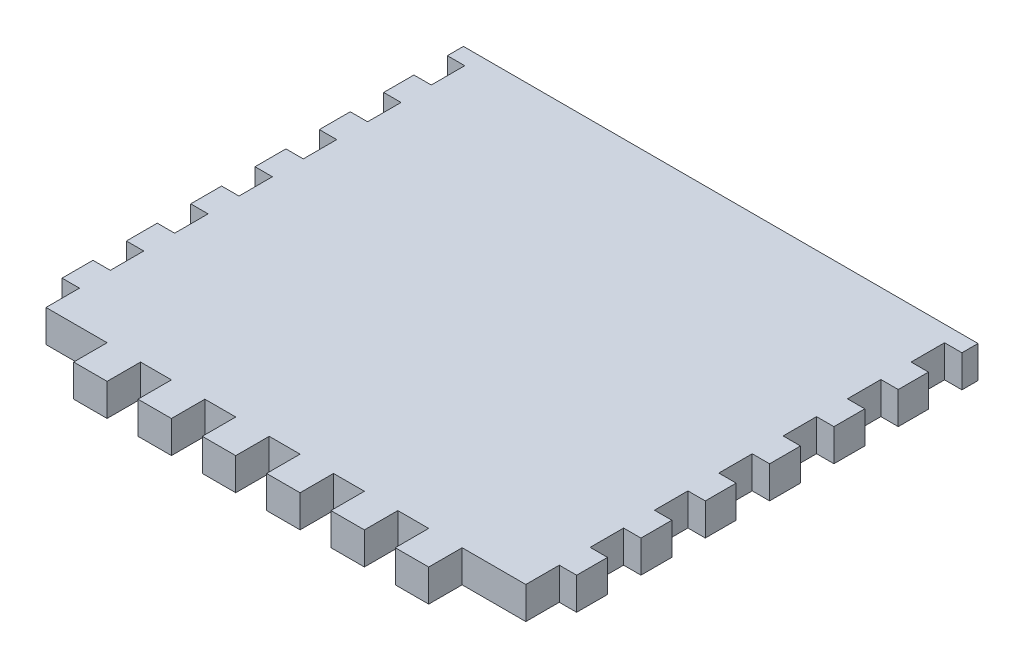
from build123d import *

# Parameters (mm, degrees)
SKETCH1_W               = 101.6
SKETCH1_H               = 107.95
BOSS_EXTRUDE1_DEPTH     = 6.35
CUT_EXTRUDE1_DEPTH      = 75.392628163
CUT_EXTRUDE1_DEPTH_BACK = 75.392628163
SKETCH2_W               = 3.429
SKETCH2_H               = 6.604


with BuildPart() as part:
    # Sketch1 → Boss-Extrude1 (new body)
    with BuildSketch(Plane(origin=(0, 0, 0), x_dir=(1, 0, 0), z_dir=(0, 1, 0))):
        Rectangle(SKETCH1_W, SKETCH1_H)
    extrude(amount=BOSS_EXTRUDE1_DEPTH)

    # Sketch2 → Cut-Extrude1 (cut, two sides: drawn at the far end of the back side and taken through both)
    with BuildSketch(Plane(origin=(0, 6.35, 0), x_dir=(1, 0, 0), z_dir=(0, 1, 0)).offset(-CUT_EXTRUDE1_DEPTH_BACK)):
        Polygon((22.098, -31.877), (28.194, -31.877), (28.194, -38.481), (34.798, -38.481), (34.798, -31.877), (47.371, -31.877), (47.371, -25.273), (50.8, -25.273), (50.8, -31.877), (50.8, -53.975), (-50.8, -53.975), (-50.8, -31.877), (-50.8, -25.273), (-47.371, -25.273), (-47.371, -31.877), (-35.306, -31.877), (-35.306, -38.481), (-28.702, -38.481), (-28.702, -31.877), (-22.606, -31.877), (-22.606, -38.481), (-16.002, -38.481), (-16.002, -31.877), (-9.906, -31.877), (-9.906, -38.481), (-3.302, -38.481), (-3.302, -31.877), (2.794, -31.877), (2.794, -38.481), (9.398, -38.481), (9.398, -31.877), (15.494, -31.877), (15.494, -38.481), (22.098, -38.481), align=None)
        with Locations((-49.0855, 47.498)):
            Rectangle(SKETCH2_W, SKETCH2_H)
        with Locations((-49.0855, 34.925)):
            Rectangle(SKETCH2_W, SKETCH2_H)
        with Locations((-49.0855, 22.225)):
            Rectangle(SKETCH2_W, SKETCH2_H)
        with Locations((-49.0855, 9.525)):
            Rectangle(SKETCH2_W, SKETCH2_H)
        with Locations((-49.0855, -3.175)):
            Rectangle(SKETCH2_W, SKETCH2_H)
        with Locations((-49.0855, -15.875)):
            Rectangle(SKETCH2_W, SKETCH2_H)
        with Locations((49.0855, -15.875)):
            Rectangle(SKETCH2_W, SKETCH2_H)
        with Locations((49.0855, -3.175)):
            Rectangle(SKETCH2_W, SKETCH2_H)
        with Locations((49.0855, 9.525)):
            Rectangle(SKETCH2_W, SKETCH2_H)
        with Locations((49.0855, 22.225)):
            Rectangle(SKETCH2_W, SKETCH2_H)
        with Locations((49.0855, 34.925)):
            Rectangle(SKETCH2_W, SKETCH2_H)
        with Locations((49.0855, 47.498)):
            Rectangle(SKETCH2_W, SKETCH2_H)
    extrude(amount=CUT_EXTRUDE1_DEPTH + CUT_EXTRUDE1_DEPTH_BACK, mode=Mode.SUBTRACT)


solid = part.part
